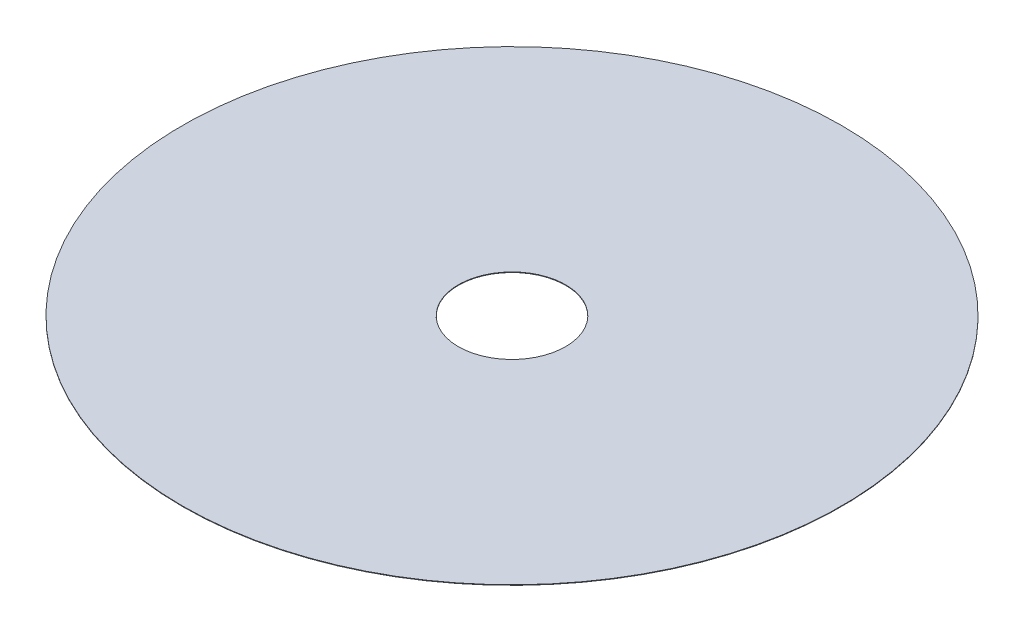
from build123d import *

# Parameters (mm, degrees)
SKETCH1_R           = 24.534
SKETCH1_R_2         = 3.9925
BOSS_EXTRUDE1_DEPTH = 0.038805556


with BuildPart() as part:
    # Sketch1 → Boss-Extrude1 (new body)
    with BuildSketch(Plane(origin=(0, 0, 0), x_dir=(1, 0, 0), z_dir=(0, 1, 0))):
        with Locations(Location((0, 0, 0), (0, 0, 270))):
            Circle(SKETCH1_R)
        with Locations(Location((0, 0, 0), (0, 0, 270))):
            Circle(SKETCH1_R_2, mode=Mode.SUBTRACT)
    extrude(amount=BOSS_EXTRUDE1_DEPTH)


solid = part.part
